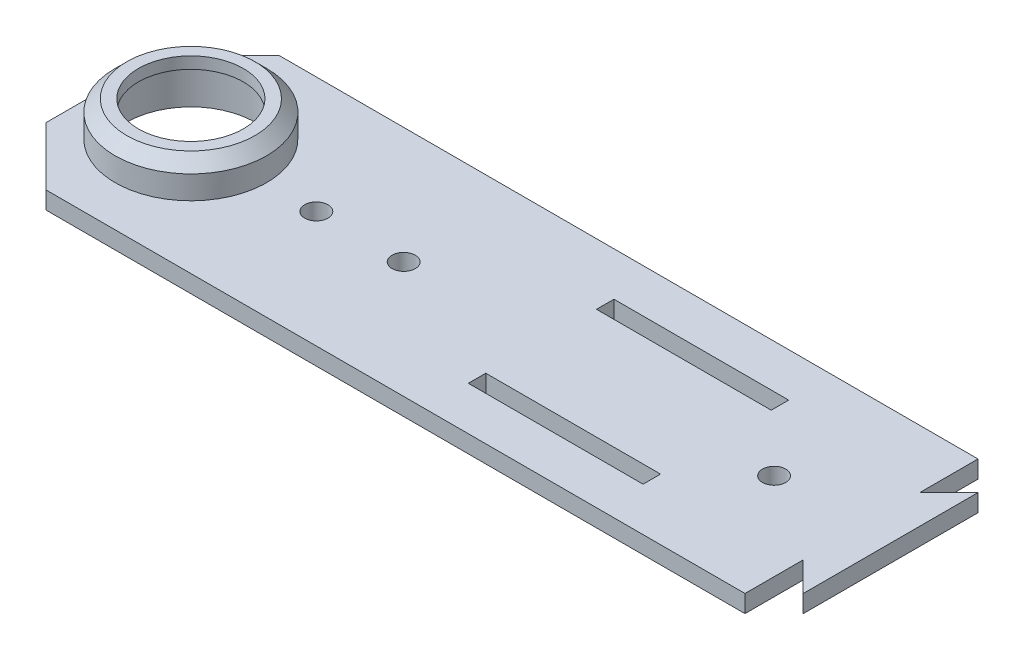
from build123d import *

# Parameters (mm, degrees)
CROQUIS1_R              = 11
CROQUIS1_R_2            = 2
CROQUIS1_W              = 30
CROQUIS1_H              = 3
SALIENTE_EXTRUIR1_DEPTH = 3
CROQUIS2_R              = 13
CROQUIS2_R_2            = 11
SALIENTE_EXTRUIR2_DEPTH = 4
CROQUIS3_R              = 13
CROQUIS3_R_2            = 9
SALIENTE_EXTRUIR3_DEPTH = 2
CHAFL_N1_SIZE           = 2
CHAFL_N2_SIZE           = 10


with BuildPart() as part:
    # Croquis1 → Saliente-Extruir1 (new body)
    with BuildSketch(Plane(origin=(0, 0, 0), x_dir=(1, 0, 0), z_dir=(0, 1, 0))):
        Polygon((65, 10), (70, 15), (70, -15), (65, -10), (65, -20), (-65, -20), (-65, 20), (65, 20), align=None)
        with Locations(Location((-50.129942902, 0, 0), (0, 0, 270))):
            Circle(CROQUIS1_R, mode=Mode.SUBTRACT)
        with Locations(Location((-28.595127909, 0, 0), (0, 0, 270))):
            Circle(CROQUIS1_R_2, mode=Mode.SUBTRACT)
        with Locations(Location((-13.595127909, 0, 0), (0, 0, 270))):
            Circle(CROQUIS1_R_2, mode=Mode.SUBTRACT)
        with Locations(Location((50, 0, 0), (0, 0, 270))):
            Circle(CROQUIS1_R_2, mode=Mode.SUBTRACT)
        with Locations((25, 11)):
            Rectangle(CROQUIS1_W, CROQUIS1_H, mode=Mode.SUBTRACT)
        with Locations((25, -11)):
            Rectangle(CROQUIS1_W, CROQUIS1_H, mode=Mode.SUBTRACT)
    extrude(amount=SALIENTE_EXTRUIR1_DEPTH)

    # Croquis2 → Saliente-Extruir2 (add)
    with BuildSketch(Plane(origin=(0, 3, 0), x_dir=(1, 0, 0), z_dir=(0, 1, 0))):
        with Locations(Location((-50.129942902, 0, 0), (0, 0, 90))):
            Circle(CROQUIS2_R)
        with Locations(Location((-50.129942902, 0, 0), (0, 0, 270))):
            Circle(CROQUIS2_R_2, mode=Mode.SUBTRACT)
    extrude(amount=SALIENTE_EXTRUIR2_DEPTH)

    # Croquis3 → Saliente-Extruir3 (add)
    with BuildSketch(Plane(origin=(0, 7, 0), x_dir=(1, 0, 0), z_dir=(0, 1, 0))):
        with Locations(Location((-50.129942902, 0, 0), (0, 0, 90))):
            Circle(CROQUIS3_R)
        with Locations(Location((-50.129942902, 0, 0), (0, 0, 270))):
            Circle(CROQUIS3_R_2, mode=Mode.SUBTRACT)
    extrude(amount=SALIENTE_EXTRUIR3_DEPTH)

    # Chaflán1
    chafl_n1_edges = [part.edges().sort_by_distance(p)[0] for p in [
        (-50.129942902, 9, 13),
    ]]
    chamfer(chafl_n1_edges, length=CHAFL_N1_SIZE)

    # Chaflán2
    chafl_n2_edges = [part.edges().sort_by_distance(p)[0] for p in [
        (-65, 1.5, 20),
        (-65, 1.5, -20),
    ]]
    chamfer(chafl_n2_edges, length=CHAFL_N2_SIZE)


solid = part.part
